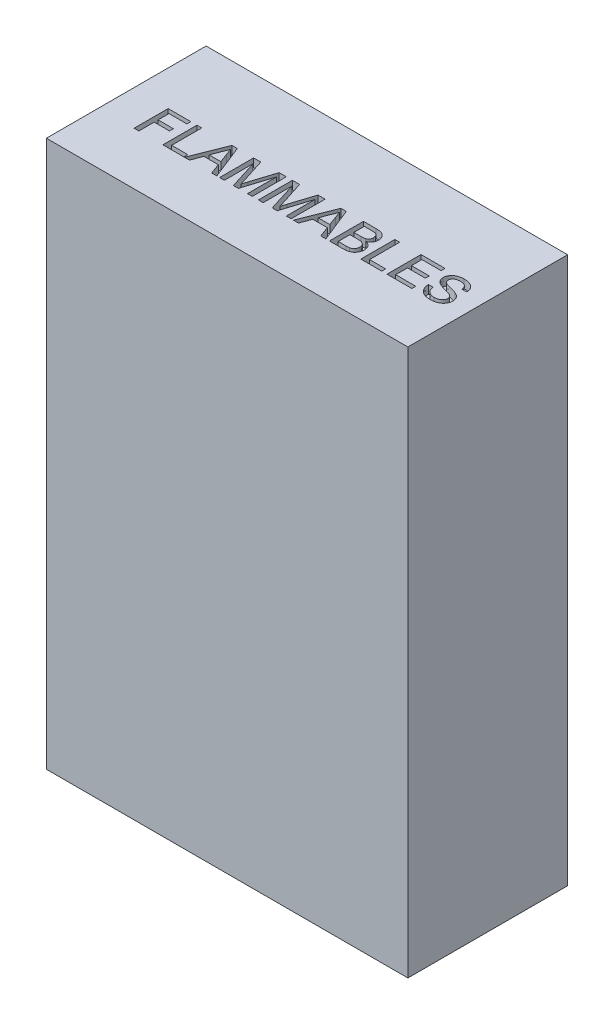
from build123d import *

# Parameters (mm, degrees)
SKETCH1_W           = 1092.2
SKETCH1_H           = 482.6
BOSS_EXTRUDE1_DEPTH = 1651
CUT_EXTRUDE1_DEPTH  = 25.4


with BuildPart() as part:
    # Sketch1 → Boss-Extrude1 (new body)
    with BuildSketch(Plane(origin=(0, 0, 0), x_dir=(1, 0, 0), z_dir=(0, 1, 0))):
        Rectangle(SKETCH1_W, SKETCH1_H)
    extrude(amount=BOSS_EXTRUDE1_DEPTH)

    # Sketch2 → Cut-Extrude1 (cut)
    # profile 1 of 10: a face of its own
    with BuildSketch(Plane(origin=(0, 1651, 0), x_dir=(1, 0, 0), z_dir=(0, 1, 0))):
        Polygon((-439.769300471, -82.45887496), (-439.769300471, 20.273872435), (-371.280802207, 20.273872435), (-371.280802207, 8.42009389), (-425.281348915, 8.42009389), (-425.281348915, -24.507068737), (-379.183321237, -24.507068737), (-379.183321237, -36.360847283), (-425.281348915, -36.360847283), (-425.281348915, -82.45887496), align=None)
    # profile 2 of 10: a face of its own
    with BuildSketch(Plane(origin=(0, 1651, 0), x_dir=(1, 0, 0), z_dir=(0, 1, 0))):
        Polygon((-352.841591136, -82.45887496), (-352.841591136, 20.273872435), (-338.35363958, 20.273872435), (-338.35363958, -70.605096415), (-289.621438892, -70.605096415), (-289.621438892, -82.45887496), align=None)
    # profile 3 of 10: a face of its own
    with BuildSketch(Plane(origin=(0, 1651, 0), x_dir=(1, 0, 0), z_dir=(0, 1, 0))):
        Polygon((-287.872183378, -82.45887496), (-247.083660673, 20.273872435), (-230.74355622, 20.273872435), (-189.955033516, -82.45887496), (-205.327902567, -82.45887496), (-217.0170453, -50.848798839), (-260.810171594, -50.848798839), (-272.499314326, -82.45887496), align=None)
        with BuildLine():
            Line((-256.447322545, -38.995020293), (-221.379894348, -38.995020293))
            Line((-221.379894348, -38.995020293), (-231.360940519, -11.994746939))
            add(Edge.make_bspline(
                [(-231.360940519, -11.994746939), (-231.743578194, -10.951493172), (-232.491707096, -8.911735076), (-233.607392681, -5.948138754), (-234.626665053, -3.133786048), (-235.626145314, -0.509030744), (-236.528393998, 1.964254366), (-237.360019736, 4.269363363), (-238.182490574, 6.390274634), (-238.676066894, 7.760601849), (-238.913608447, 8.42009389)],
                knots=[0, 0, 0, 0, 1.225184869, 2.395467751, 3.491410812, 4.525364584, 5.492066482, 6.394148129, 7.227157926, 8, 8, 8, 8], degree=3))
            add(Edge.make_bspline(
                [(-238.913608447, 8.42009389), (-239.306548024, 6.793844596), (-240.094047392, 3.534640473), (-241.742879335, -1.240530795), (-243.629085812, -5.972030967), (-245.160910225, -9.020977379), (-245.931209982, -10.554183574)],
                knots=[0, 0, 0, 0, 0.9891762, 1.982431084, 2.985436691, 4, 4, 4, 4], degree=3))
            Line((-245.931209982, -10.554183574), (-256.447322545, -38.995020293))
        make_face(mode=Mode.SUBTRACT)
    # profile 4 of 10: a face of its own
    with BuildSketch(Plane(origin=(0, 1651, 0), x_dir=(1, 0, 0), z_dir=(0, 1, 0))):
        with BuildLine():
            Line((-181.620345476, -82.45887496), (-181.620345476, 20.273872435))
            Line((-181.620345476, 20.273872435), (-159.826679712, 20.273872435))
            Line((-159.826679712, 20.273872435), (-136.85998378, -51.816034241))
            add(Edge.make_bspline(
                [(-136.85998378, -51.816034241), (-136.607234315, -52.63268725), (-136.118431562, -54.212046629), (-135.393595073, -56.4927869), (-134.734115383, -58.612223752), (-134.140150077, -60.577103465), (-133.579617343, -62.377670501), (-133.094284317, -64.02869984), (-132.630290155, -65.511844876), (-132.358368842, -66.454432042), (-132.229601536, -66.900790619)],
                knots=[0, 0, 0, 0, 1.300204174, 2.514519184, 3.639827924, 4.676153899, 5.636536826, 6.507959918, 7.293450077, 8, 8, 8, 8], degree=3))
            add(Edge.make_bspline(
                [(-132.229601536, -66.900790619), (-132.086184657, -66.413551201), (-131.780984369, -65.376674559), (-131.286205913, -63.746363781), (-130.75974755, -61.942241453), (-130.12973826, -59.995317497), (-129.473028136, -57.875050786), (-128.783725393, -55.583202134), (-127.988628103, -53.1426529), (-127.460246217, -51.453023154), (-127.187629758, -50.581265642)],
                knots=[0, 0, 0, 0, 0.713638162, 1.518667645, 2.393860736, 3.354087503, 4.393659122, 5.512594909, 6.716633584, 8, 8, 8, 8], degree=3))
            Line((-127.187629758, -50.581265642), (-104.447308069, 20.273872435))
            Line((-104.447308069, 20.273872435), (-82.838857595, 20.273872435))
            Line((-82.838857595, 20.273872435), (-82.838857595, -82.45887496))
            Line((-82.838857595, -82.45887496), (-97.326809151, -82.45887496))
            Line((-97.326809151, -82.45887496), (-97.326809151, 4.468834374))
            Line((-97.326809151, 4.468834374), (-124.738672038, -82.45887496))
            Line((-124.738672038, -82.45887496), (-139.885166846, -82.45887496))
            Line((-139.885166846, -82.45887496), (-167.13239392, 4.468834374))
            Line((-167.13239392, 4.468834374), (-167.13239392, -82.45887496))
            Line((-167.13239392, -82.45887496), (-181.620345476, -82.45887496))
        make_face()
    # profile 5 of 10: a face of its own
    with BuildSketch(Plane(origin=(0, 1651, 0), x_dir=(1, 0, 0), z_dir=(0, 1, 0))):
        with BuildLine():
            Line((-64.399646524, -82.45887496), (-64.399646524, 20.273872435))
            Line((-64.399646524, 20.273872435), (-42.605980761, 20.273872435))
            Line((-42.605980761, 20.273872435), (-19.639284828, -51.816034241))
            add(Edge.make_bspline(
                [(-19.639284828, -51.816034241), (-19.386535363, -52.63268725), (-18.897732611, -54.212046629), (-18.172896121, -56.4927869), (-17.513416432, -58.612223752), (-16.919451125, -60.577103465), (-16.358918391, -62.377670501), (-15.873585365, -64.02869984), (-15.409591203, -65.511844876), (-15.13766989, -66.454432042), (-15.008902584, -66.900790619)],
                knots=[0, 0, 0, 0, 1.300204174, 2.514519184, 3.639827924, 4.676153899, 5.636536826, 6.507959918, 7.293450077, 8, 8, 8, 8], degree=3))
            add(Edge.make_bspline(
                [(-15.008902584, -66.900790619), (-14.865485706, -66.413551201), (-14.560285417, -65.376674559), (-14.065506962, -63.746363781), (-13.539048598, -61.942241453), (-12.909039308, -59.995317497), (-12.252329184, -57.875050786), (-11.563026442, -55.583202134), (-10.767929151, -53.1426529), (-10.239547265, -51.453023154), (-9.966930807, -50.581265642)],
                knots=[0, 0, 0, 0, 0.713638162, 1.518667645, 2.393860736, 3.354087503, 4.393659122, 5.512594909, 6.716633584, 8, 8, 8, 8], degree=3))
            Line((-9.966930807, -50.581265642), (12.773390882, 20.273872435))
            Line((12.773390882, 20.273872435), (34.381841356, 20.273872435))
            Line((34.381841356, 20.273872435), (34.381841356, -82.45887496))
            Line((34.381841356, -82.45887496), (19.893889801, -82.45887496))
            Line((19.893889801, -82.45887496), (19.893889801, 4.468834374))
            Line((19.893889801, 4.468834374), (-7.517973086, -82.45887496))
            Line((-7.517973086, -82.45887496), (-22.664467895, -82.45887496))
            Line((-22.664467895, -82.45887496), (-49.911694968, 4.468834374))
            Line((-49.911694968, 4.468834374), (-49.911694968, -82.45887496))
            Line((-49.911694968, -82.45887496), (-64.399646524, -82.45887496))
        make_face()
    # profile 6 of 10: a face of its own
    with BuildSketch(Plane(origin=(0, 1651, 0), x_dir=(1, 0, 0), z_dir=(0, 1, 0))):
        Polygon((41.399442891, -82.45887496), (82.187965595, 20.273872435), (98.528070049, 20.273872435), (139.316592753, -82.45887496), (123.943723701, -82.45887496), (112.254580969, -50.848798839), (68.461454675, -50.848798839), (56.772311943, -82.45887496), align=None)
        with BuildLine():
            Line((72.824303723, -38.995020293), (107.891731921, -38.995020293))
            Line((107.891731921, -38.995020293), (97.91068575, -11.994746939))
            add(Edge.make_bspline(
                [(97.91068575, -11.994746939), (97.528048075, -10.951493172), (96.779919172, -8.911735076), (95.664233588, -5.948138754), (94.644961216, -3.133786048), (93.645480955, -0.509030744), (92.743232271, 1.964254366), (91.911606533, 4.269363363), (91.089135694, 6.390274634), (90.595559374, 7.760601849), (90.358017822, 8.42009389)],
                knots=[0, 0, 0, 0, 1.225184869, 2.395467751, 3.491410812, 4.525364584, 5.492066482, 6.394148129, 7.227157926, 8, 8, 8, 8], degree=3))
            add(Edge.make_bspline(
                [(90.358017822, 8.42009389), (89.965078245, 6.793844596), (89.177578877, 3.534640473), (87.528746934, -1.240530795), (85.642540457, -5.972030967), (84.110716044, -9.020977379), (83.340416287, -10.554183574)],
                knots=[0, 0, 0, 0, 0.9891762, 1.982431084, 2.985436691, 4, 4, 4, 4], degree=3))
            Line((83.340416287, -10.554183574), (72.824303723, -38.995020293))
        make_face(mode=Mode.SUBTRACT)
    # profile 7 of 10: a face of its own
    with BuildSketch(Plane(origin=(0, 1651, 0), x_dir=(1, 0, 0), z_dir=(0, 1, 0))):
        with BuildLine():
            Line((150.285453803, -82.45887496), (150.285453803, 20.273872435))
            Line((150.285453803, 20.273872435), (188.748495646, 20.273872435))
            add(Edge.make_bspline(
                [(188.748495646, 20.273872435), (189.70231547, 20.270213352), (191.563489099, 20.263073442), (194.281187455, 20.084511662), (196.855050737, 19.840276178), (199.290619874, 19.52544915), (201.577356185, 19.068641526), (203.713128692, 18.515249625), (205.709051908, 17.876929946), (208.148763889, 16.904562319), (210.96026447, 15.407881853), (213.971648684, 13.174598427), (216.591669949, 10.493226135), (218.747562149, 7.418880968), (220.523784805, 4.134900519), (221.783105875, 0.703847734), (222.588258042, -2.799575008), (222.679611956, -5.17184397), (222.725211582, -6.355970339)],
                knots=[0, 0, 0, 0, 0.939712594, 1.833646414, 2.682508961, 3.487467313, 4.25240329, 4.978730417, 5.660668875, 6.315918528, 7.564895217, 8.787077865, 9.996481721, 11.241996224, 12.475862915, 13.665015424, 14.834484263, 16, 16, 16, 16], degree=3))
            add(Edge.make_bspline(
                [(222.725211582, -6.355970339), (222.677276747, -7.457639322), (222.581869214, -9.65035616), (221.822531996, -12.880361428), (220.624065555, -16.016676432), (218.929400077, -19.021173025), (216.763405176, -21.838884625), (214.078190028, -24.374475896), (210.912340929, -26.6333809), (208.536371285, -27.837443674), (207.311183577, -28.458328252)],
                knots=[0, 0, 0, 0, 0.926741525, 1.844548388, 2.778836836, 3.746021974, 4.738420572, 5.759761325, 6.844803049, 8, 8, 8, 8], degree=3))
            add(Edge.make_bspline(
                [(207.311183577, -28.458328252), (208.069092812, -28.695586346), (209.552950144, -29.160097325), (211.686149208, -30.010087265), (213.688571637, -30.977922458), (215.564576154, -32.065193331), (217.301486831, -33.281968547), (218.894402755, -34.630144994), (220.354368515, -36.088859991), (221.67877574, -37.657226219), (222.842128538, -39.325150908), (223.885510666, -41.056179811), (224.747090241, -42.87115833), (225.453295643, -44.765374328), (226.004240845, -46.727123201), (226.399879472, -48.763950187), (226.625383389, -50.871114173), (226.659253357, -52.302553587), (226.676471097, -53.030223363)],
                knots=[0, 0, 0, 0, 1.127427615, 2.20731145, 3.257257018, 4.283066884, 5.282973838, 6.264540225, 7.242620376, 8.210460609, 9.17525685, 10.12748095, 11.077310519, 12.023587065, 12.994999128, 13.967387486, 14.966724908, 16, 16, 16, 16], degree=3))
            add(Edge.make_bspline(
                [(226.676471097, -53.030223363), (226.640982709, -54.198487006), (226.570640406, -56.5141277), (226.005713293, -59.922361382), (225.051016425, -63.200794935), (223.736957378, -66.296420051), (222.17120313, -69.158781227), (220.391668568, -71.712932515), (218.443735507, -73.932591875), (216.272552154, -75.799722143), (213.892123572, -77.384369345), (211.235216388, -78.718745922), (208.322373326, -79.895538185), (205.094392476, -80.835603286), (201.552743208, -81.582389777), (197.649362094, -82.067578176), (193.378252178, -82.414908027), (190.402517812, -82.443809725), (188.85139303, -82.45887496)],
                knots=[0, 0, 0, 0, 1.028073207, 2.037766189, 3.031549473, 4.027532207, 4.992436545, 5.898794514, 6.762903869, 7.584966804, 8.412380356, 9.273953678, 10.198004568, 11.174406109, 12.229717296, 13.381036288, 14.634844708, 16, 16, 16, 16], degree=3))
            Line((188.85139303, -82.45887496), (150.285453803, -82.45887496))
        make_face()
        with BuildLine():
            Line((164.773405359, -23.189982232), (185.949686823, -23.189982232))
            add(Edge.make_bspline(
                [(185.949686823, -23.189982232), (186.642627479, -23.187240697), (187.973923003, -23.181973589), (189.894285078, -23.108534385), (191.666687223, -23.045880229), (193.284273552, -22.888623138), (194.755057716, -22.734596803), (196.073153817, -22.527253347), (197.245017961, -22.2936243), (197.962550575, -22.076915796), (198.297372808, -21.97579311)],
                knots=[0, 0, 0, 0, 1.335841395, 2.566453063, 3.705076039, 4.753984432, 5.69893722, 6.555639608, 7.326018133, 8, 8, 8, 8], degree=3))
            add(Edge.make_bspline(
                [(198.297372808, -21.97579311), (199.08408498, -21.700207775), (200.600701415, -21.168936919), (202.633109301, -19.962367394), (204.36413007, -18.514489853), (205.789124966, -16.79973834), (206.884162934, -14.827289493), (207.696101978, -12.638047108), (208.14065662, -10.201407605), (208.204183557, -8.511683723), (208.237260026, -7.631897891)],
                knots=[0, 0, 0, 0, 1.059015028, 2.041559358, 2.989777133, 3.920090524, 4.862499371, 5.848878527, 6.879979022, 8, 8, 8, 8], degree=3))
            add(Edge.make_bspline(
                [(208.237260026, -7.631897891), (208.210664306, -6.786366783), (208.158832314, -5.138524161), (207.723749085, -2.745570972), (206.97085363, -0.519367444), (205.95122701, 1.539598075), (204.660108791, 3.371343626), (203.119114159, 4.946216031), (201.27311136, 6.136750231), (199.54765169, 6.879407919), (197.995737464, 7.344010372), (196.609156609, 7.618896519), (195.036360353, 7.861098552), (193.272173055, 8.067010667), (191.315927373, 8.22681744), (189.161595772, 8.353773331), (186.814306498, 8.40767572), (185.18825875, 8.415851436), (184.344487645, 8.42009389)],
                knots=[0, 0, 0, 0, 1.216168307, 2.37017178, 3.484610845, 4.588286376, 5.664695412, 6.69777344, 7.738183022, 8.803673002, 9.390844981, 10.0665252, 10.835811589, 11.680682236, 12.621801058, 13.660007223, 14.785756265, 16, 16, 16, 16], degree=3))
            Line((184.344487645, 8.42009389), (164.773405359, 8.42009389))
            Line((164.773405359, 8.42009389), (164.773405359, -23.189982232))
        make_face(mode=Mode.SUBTRACT)
        with BuildLine():
            Line((164.773405359, -70.605096415), (189.077767273, -70.605096415))
            add(Edge.make_bspline(
                [(189.077767273, -70.605096415), (190.045024809, -70.593983995), (191.822143767, -70.573567414), (194.252895303, -70.509519605), (196.217694056, -70.353074766), (197.365032698, -70.184623614), (197.865203799, -70.111188975)],
                knots=[0, 0, 0, 0, 1.317581857, 2.420761387, 3.311546315, 4, 4, 4, 4], degree=3))
            add(Edge.make_bspline(
                [(197.865203799, -70.111188975), (198.582300672, -69.960462479), (199.970785617, -69.668617013), (201.928216242, -69.017248379), (203.722932663, -68.271070894), (205.323610814, -67.322762206), (206.805800379, -66.229901405), (208.093933423, -64.864865965), (209.280365103, -63.313954578), (210.308303698, -61.539112915), (211.139541314, -59.575665158), (211.774842001, -57.45394796), (212.113249422, -55.181400509), (212.163075425, -53.621173267), (212.188519541, -52.824428596)],
                knots=[0, 0, 0, 0, 1.067651492, 2.067249321, 3.003744366, 3.895862395, 4.774133402, 5.679610569, 6.621910665, 7.616993802, 8.661192143, 9.724711987, 10.838102842, 12, 12, 12, 12], degree=3))
            add(Edge.make_bspline(
                [(212.188519541, -52.824428596), (212.160172029, -51.889002608), (212.104891487, -50.06482644), (211.579430976, -47.428799453), (210.711456203, -44.983851648), (209.489600638, -42.763843096), (207.990931006, -40.767136538), (206.177692082, -39.073384718), (204.063442137, -37.729308885), (201.641683217, -36.674469483), (198.811132146, -35.923969416), (195.493643031, -35.414800579), (191.636151594, -35.086246134), (188.879594834, -35.058529123), (187.410829665, -35.043760778)],
                knots=[0, 0, 0, 0, 0.96167883, 1.875371887, 2.752872588, 3.621584364, 4.472914353, 5.312011319, 6.159851575, 7.038572308, 8.019870099, 9.164119506, 10.488969081, 12, 12, 12, 12], degree=3))
            Line((187.410829665, -35.043760778), (164.773405359, -35.043760778))
            Line((164.773405359, -35.043760778), (164.773405359, -70.605096415))
        make_face(mode=Mode.SUBTRACT)
    # profile 8 of 10: a face of its own
    with BuildSketch(Plane(origin=(0, 1651, 0), x_dir=(1, 0, 0), z_dir=(0, 1, 0))):
        Polygon((245.115682168, -82.45887496), (245.115682168, 20.273872435), (259.603633724, 20.273872435), (259.603633724, -70.605096415), (308.335834412, -70.605096415), (308.335834412, -82.45887496), align=None)
    # profile 9 of 10: a face of its own
    with BuildSketch(Plane(origin=(0, 1651, 0), x_dir=(1, 0, 0), z_dir=(0, 1, 0))):
        Polygon((324.140872473, -82.45887496), (324.140872473, 20.273872435), (396.580630252, 20.273872435), (396.580630252, 8.42009389), (338.628824029, 8.42009389), (338.628824029, -23.189982232), (392.629370737, -23.189982232), (392.629370737, -35.043760778), (338.628824029, -35.043760778), (338.628824029, -70.605096415), (399.214803262, -70.605096415), (399.214803262, -82.45887496), align=None)
    # profile 10 of 10: a face of its own
    with BuildSketch(Plane(origin=(0, 1651, 0), x_dir=(1, 0, 0), z_dir=(0, 1, 0))):
        with BuildLine():
            Line((413.702754818, -46.897539323), (428.190706374, -46.897539323))
            add(Edge.make_bspline(
                [(428.190706374, -46.897539323), (428.350065436, -48.198358149), (428.656202775, -50.697301159), (429.512193353, -54.239176694), (430.613908458, -57.423686294), (431.986615106, -60.293094024), (433.7923584, -62.812995858), (435.967968455, -65.08590883), (438.61012846, -67.054113834), (441.592524808, -68.805687333), (444.914082014, -70.180949563), (448.460140569, -71.200454091), (452.213788866, -71.804518647), (454.784056221, -71.882410214), (456.0964767, -71.92218292)],
                knots=[0, 0, 0, 0, 1.125557648, 2.162256852, 3.1243583, 4.018160113, 4.88511607, 5.777380551, 6.711250965, 7.707237736, 8.743031335, 9.791730543, 10.872421559, 12, 12, 12, 12], degree=3))
            add(Edge.make_bspline(
                [(456.0964767, -71.92218292), (457.257855795, -71.90068703), (459.522320141, -71.858774207), (462.798120929, -71.355297361), (465.880658988, -70.64112898), (468.712565072, -69.560837495), (471.283392567, -68.249024905), (473.515868232, -66.662356816), (475.421837202, -64.873031066), (476.914349058, -62.833917807), (478.086836571, -60.697268108), (478.946977368, -58.501012579), (479.459345613, -56.257341447), (479.524634652, -54.747683834), (479.557080072, -53.997458765)],
                knots=[0, 0, 0, 0, 1.267006637, 2.470417599, 3.611360613, 4.716023143, 5.771382139, 6.754486395, 7.697536124, 8.612899418, 9.501261124, 10.352596716, 11.181322154, 12, 12, 12, 12], degree=3))
            add(Edge.make_bspline(
                [(479.557080072, -53.997458765), (479.522395316, -53.254833043), (479.45460401, -51.803372129), (479.012826846, -49.690226349), (478.173166919, -47.756084167), (477.08361167, -45.922002913), (475.567854286, -44.245132965), (473.652865889, -42.700046884), (471.296454477, -41.29925688), (469.537747871, -40.532102623), (468.608798498, -40.126891508)],
                knots=[0, 0, 0, 0, 0.942140154, 1.841411588, 2.718743672, 3.605002079, 4.535543111, 5.568170452, 6.715506882, 8, 8, 8, 8], degree=3))
            add(Edge.make_bspline(
                [(468.608798498, -40.126891508), (468.246866084, -39.97836639), (467.429195012, -39.642821165), (466.027745164, -39.198617061), (464.364747436, -38.62421583), (462.400249646, -38.032676046), (460.144768614, -37.406909686), (457.602059488, -36.69863704), (454.773543094, -35.945427849), (451.739441039, -35.143718709), (448.67592255, -34.328503457), (445.749088531, -33.512524771), (443.056262092, -32.684201881), (440.575385349, -31.886641299), (438.31924835, -31.085790239), (436.281447661, -30.303574282), (434.459442639, -29.555863552), (433.346631332, -29.006083322), (432.821088618, -28.746440925)],
                knots=[0, 0, 0, 0, 0.499201778, 1.127787504, 1.87543728, 2.745208432, 3.745951656, 4.863402235, 6.114490242, 7.482339553, 8.869366102, 10.161191451, 11.360587006, 12.46547846, 13.487450326, 14.41601931, 15.251940103, 16, 16, 16, 16], degree=3))
            add(Edge.make_bspline(
                [(432.821088618, -28.746440925), (431.611961418, -28.093235582), (429.278031245, -26.83237927), (426.136819726, -24.577964658), (423.490030133, -22.076274383), (421.348828753, -19.330936002), (419.670853018, -16.388379777), (418.538730127, -13.243603336), (417.763319403, -9.953690245), (417.690855251, -7.691359198), (417.654014333, -6.541185629)],
                knots=[0, 0, 0, 0, 1.158441928, 2.236094408, 3.251151369, 4.220012324, 5.163146324, 6.095083285, 7.031536583, 8, 8, 8, 8], degree=3))
            add(Edge.make_bspline(
                [(417.654014333, -6.541185629), (417.70290956, -5.267562683), (417.800161811, -2.734335885), (418.662842575, 0.983016519), (420.038834899, 4.560098311), (421.605132047, 7.399996015), (423.132617895, 9.54751395), (424.398915265, 11.09411711), (425.819315433, 12.523743808), (427.350075012, 13.856350667), (429.01855788, 15.072027001), (430.783368811, 16.220735577), (432.708384103, 17.208078164), (435.413316868, 18.464742422), (439.031865146, 19.719639199), (443.587164834, 20.813122564), (448.381468181, 21.457052183), (451.64937797, 21.545692), (453.318247353, 21.59095894)],
                knots=[0, 0, 0, 0, 1.199927478, 2.386647047, 3.578628709, 4.806592355, 5.433127754, 6.062729195, 6.689531802, 7.331674828, 7.974827539, 8.635320743, 9.315455226, 10.01318112, 11.447700238, 12.918145351, 14.426146008, 16, 16, 16, 16], degree=3))
            add(Edge.make_bspline(
                [(453.318247353, 21.59095894), (455.144935744, 21.549103166), (458.701850012, 21.467601907), (463.87014698, 20.789526284), (468.690753181, 19.62509201), (472.471237962, 18.321624667), (475.26610615, 17.002040839), (477.251658333, 15.972382977), (479.094643392, 14.781910919), (480.811651911, 13.493633912), (482.418632574, 12.108140308), (483.874282371, 10.59247379), (485.241809675, 8.99834616), (486.848844822, 6.709678348), (488.581569406, 3.680639448), (490.079745664, -0.24360076), (491.109010228, -4.385314099), (491.30922587, -7.248586567), (491.410858617, -8.702030676)],
                knots=[0, 0, 0, 0, 1.607600973, 3.130308851, 4.577334065, 5.967726088, 6.640410691, 7.296826776, 7.935019992, 8.569057421, 9.185393759, 9.8003086, 10.417295362, 11.032210203, 12.259799365, 13.477607022, 14.719591916, 16, 16, 16, 16], degree=3))
            Line((491.410858617, -8.702030676), (476.922907061, -8.702030676))
            add(Edge.make_bspline(
                [(476.922907061, -8.702030676), (476.830852752, -7.966400114), (476.650729752, -6.526989126), (476.203868498, -4.443225173), (475.577458941, -2.50791898), (474.843741377, -0.703022506), (473.954322079, 0.952691338), (472.917516542, 2.475121027), (471.720698674, 3.846329743), (470.394663858, 5.102550075), (468.899061097, 6.196367317), (467.241575265, 7.145834263), (465.419408472, 7.947916419), (463.434166043, 8.604847865), (461.28545494, 9.114206812), (458.968387894, 9.488900978), (456.483860487, 9.680798636), (454.772805165, 9.718055438), (453.894472699, 9.737180395)],
                knots=[0, 0, 0, 0, 1.074487479, 2.102453544, 3.083708351, 4.020042547, 4.923259678, 5.803182661, 6.684453325, 7.556870173, 8.445961597, 9.363679789, 10.320905216, 11.327237703, 12.390948353, 13.519046902, 14.726457512, 16, 16, 16, 16], degree=3))
            add(Edge.make_bspline(
                [(453.894472699, 9.737180395), (452.981487069, 9.730298741), (451.214171427, 9.716977551), (448.659316247, 9.474148905), (446.291295735, 9.14097939), (444.114177219, 8.649526025), (442.135092654, 8.006211919), (440.324669588, 7.263331746), (438.733574632, 6.321908543), (437.324716618, 5.273285537), (436.109398141, 4.113042108), (435.061973643, 2.890426054), (434.135607575, 1.641358712), (433.415800706, 0.297565245), (432.829769725, -1.09006285), (432.45171535, -2.547608435), (432.18404402, -4.048110704), (432.156185756, -5.071933491), (432.141965889, -5.594529703)],
                knots=[0, 0, 0, 0, 1.464176581, 2.834285765, 4.113735764, 5.29917439, 6.409476712, 7.449999357, 8.431575861, 9.367089851, 10.262376129, 11.120706676, 11.948504824, 12.751342953, 13.560717798, 14.359016663, 15.162382702, 16, 16, 16, 16], degree=3))
            add(Edge.make_bspline(
                [(432.141965889, -5.594529703), (432.179406166, -6.478397106), (432.252074292, -8.193902238), (432.994122101, -10.631117907), (434.135396824, -12.852797905), (435.25973427, -14.061602647), (435.825692208, -14.670078902)],
                knots=[0, 0, 0, 0, 1.050964922, 2.039826012, 3.013306874, 4, 4, 4, 4], degree=3))
            add(Edge.make_bspline(
                [(435.825692208, -14.670078902), (436.182466058, -14.97416622), (436.971449399, -15.646636547), (438.439474529, -16.53657229), (440.259607971, -17.43573894), (442.444011559, -18.329580171), (444.988926947, -19.228947122), (447.890249137, -20.154955995), (451.159028924, -21.074655935), (454.695650341, -21.960938997), (458.268462628, -22.850784986), (461.663835456, -23.737239511), (464.781362444, -24.577354462), (467.61609741, -25.396748982), (470.170974393, -26.19310612), (472.437114259, -26.983110584), (474.432850937, -27.709714301), (475.655475428, -28.22093934), (476.223204856, -28.458328252)],
                knots=[0, 0, 0, 0, 0.523891492, 1.158553688, 1.913783773, 2.794766643, 3.797521443, 4.933638669, 6.202080764, 7.596537849, 9.013317056, 10.322179469, 11.523240428, 12.626146501, 13.623953177, 14.517289671, 15.311498917, 16, 16, 16, 16], degree=3))
            add(Edge.make_bspline(
                [(476.223204856, -28.458328252), (476.961849656, -28.798890939), (478.411685614, -29.467358421), (480.465572391, -30.608666086), (482.382071582, -31.793852655), (484.145699153, -33.054827352), (485.750752444, -34.394242606), (487.215177826, -35.796751665), (488.547819914, -37.254472199), (489.694906727, -38.814059754), (490.724872997, -40.412468773), (491.626162067, -42.072039079), (492.351862718, -43.802530284), (492.988347453, -45.583082926), (493.446162544, -47.433501928), (493.805181915, -49.335096823), (494.01459191, -51.29680566), (494.034797337, -52.625006817), (494.045031627, -53.297756559)],
                knots=[0, 0, 0, 0, 1.198900896, 2.353241543, 3.461831299, 4.520043694, 5.547003373, 6.541368882, 7.508191797, 8.454912692, 9.392021408, 10.310662301, 11.235020644, 12.156274873, 13.095836685, 14.042125239, 15.00831306, 16, 16, 16, 16], degree=3))
            add(Edge.make_bspline(
                [(494.045031627, -53.297756559), (493.991417352, -54.640382199), (493.884975197, -57.305940345), (492.968469847, -61.23509633), (491.528688416, -65.042426548), (489.840188047, -68.063752805), (488.244044848, -70.371606986), (486.903209269, -72.030387097), (485.416299701, -73.564182082), (483.819922349, -75.021042828), (482.101682846, -76.371244615), (480.247095369, -77.61524721), (478.275734211, -78.766000569), (475.46068005, -80.168260925), (471.721820459, -81.635158413), (466.959263922, -82.856740963), (461.940106188, -83.64921177), (458.493642661, -83.733127685), (456.734440476, -83.775961466)],
                knots=[0, 0, 0, 0, 1.197055466, 2.376552968, 3.581957237, 4.820753935, 5.454298064, 6.085440993, 6.72202542, 7.359198513, 8.013298489, 8.67051481, 9.351020706, 10.049282741, 11.476266879, 12.925760103, 14.430794493, 16, 16, 16, 16], degree=3))
            add(Edge.make_bspline(
                [(456.734440476, -83.775961466), (455.615903214, -83.766730786), (453.424848506, -83.748649203), (450.205338322, -83.52967553), (447.120022871, -83.212919349), (444.171929959, -82.741107493), (441.370304515, -82.122115956), (438.705089973, -81.378826751), (436.169969023, -80.52277599), (433.773799459, -79.516075132), (431.522836285, -78.346398705), (429.376604909, -77.084613787), (427.370186907, -75.65432145), (425.499358521, -74.077996556), (423.71671694, -72.401177727), (422.096147352, -70.555385059), (420.582554531, -68.59459618), (419.210523635, -66.500865204), (417.984822908, -64.301585058), (416.882568748, -62.033690289), (415.953904196, -59.68072909), (415.205488934, -57.254593276), (414.571543314, -54.771518579), (414.131916678, -52.210788067), (413.808688368, -49.58044151), (413.738274572, -47.797122386), (413.702754818, -46.897539323)],
                knots=[0, 0, 0, 0, 1.259822038, 2.467811403, 3.633536148, 4.752793854, 5.829021491, 6.863980041, 7.868367876, 8.841470325, 9.788447787, 10.724101269, 11.643985084, 12.560193707, 13.478453146, 14.398077254, 15.323914234, 16.266973849, 17.21495974, 18.158525798, 19.105629373, 20.061269543, 21.017128399, 21.990322895, 22.986232211, 24, 24, 24, 24], degree=3))
        make_face()
    extrude(amount=-CUT_EXTRUDE1_DEPTH, mode=Mode.SUBTRACT)


solid = part.part
